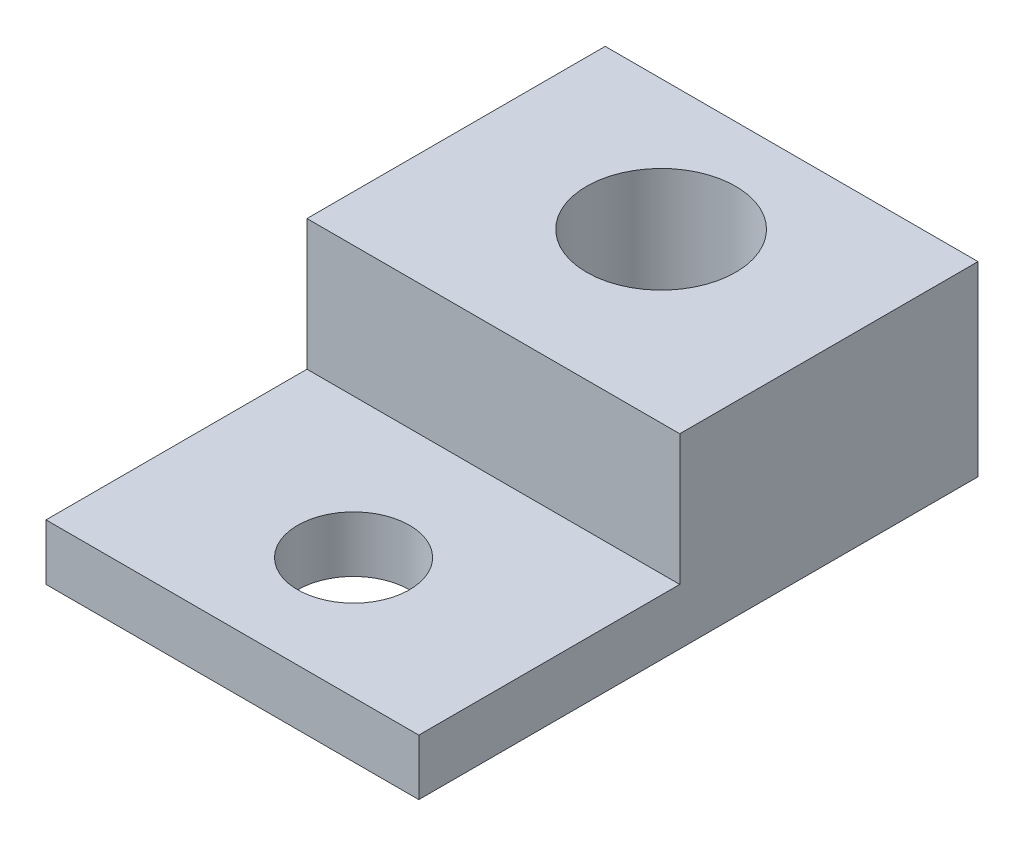
from build123d import *

# Parameters (mm, degrees)
SKETCH1_W               = 20
SKETCH1_H               = 30
BOSS_EXTRUDE1_DEPTH     = 3
SKETCH2_W               = 5
SKETCH2_H               = 12
BOSS_EXTRUDE2_DEPTH     = 3
SKETCH3_R               = 7
SKETCH3_R_2             = 4
BOSS_EXTRUDE3_DEPTH     = 7
SKETCH4_R               = 4
BOSS_EXTRUDE4_DEPTH     = 1
CUT_EXTRUDE1_DEPTH      = 20.339079606
CUT_EXTRUDE1_DEPTH_BACK = 20.339079606
SKETCH5_R               = 3
SKETCH6_R               = 7
SKETCH6_R_2             = 4
BOSS_EXTRUDE6_DEPTH     = 7


with BuildPart() as part:
    # Sketch1 → Boss-Extrude1 (new body)
    with BuildSketch(Plane(origin=(0, 0, 0), x_dir=(1, 0, 0), z_dir=(0, 1, 0))):
        Rectangle(SKETCH1_W, SKETCH1_H)
    extrude(amount=BOSS_EXTRUDE1_DEPTH)

    # Sketch2 → Boss-Extrude2 (add)
    with BuildSketch(Plane.XZ):
        with Locations((0, -9)):
            Rectangle(SKETCH2_W, SKETCH2_H)
    extrude(amount=BOSS_EXTRUDE2_DEPTH)

    # Sketch3 → Boss-Extrude3 (add)
    with BuildSketch(Plane(origin=(0, 3, 0), x_dir=(1, 0, 0), z_dir=(0, 1, 0))):
        with Locations(Location((0, 8, 0), (0, 0, 90))):
            Circle(SKETCH3_R)
        with Locations(Location((0, 8, 0), (0, 0, 270))):
            Circle(SKETCH3_R_2, mode=Mode.SUBTRACT)
    extrude(amount=BOSS_EXTRUDE3_DEPTH)

    # Sketch4 → Boss-Extrude4 (add)
    with BuildSketch(Plane(origin=(0, 3, 0), x_dir=(1, 0, 0), z_dir=(0, 1, 0))):
        with Locations(Location((0, 8, 0), (0, 0, 270))):
            Circle(SKETCH4_R)
    extrude(amount=BOSS_EXTRUDE4_DEPTH)

    # Sketch5 → Cut-Extrude1 (cut, two sides: drawn at the far end of the back side and taken through both)
    with BuildSketch(Plane(origin=(0, 3, 0), x_dir=(1, 0, 0), z_dir=(0, 1, 0)).offset(-CUT_EXTRUDE1_DEPTH_BACK)):
        with Locations(Location((0, -8.5, 0), (0, 0, 90))):
            Circle(SKETCH5_R)
    extrude(amount=CUT_EXTRUDE1_DEPTH + CUT_EXTRUDE1_DEPTH_BACK, mode=Mode.SUBTRACT)

    # Sketch6 → Boss-Extrude6 (add)
    # profile 1 of 2: a face of its own
    with BuildSketch(Plane(origin=(0, 3, 0), x_dir=(1, 0, 0), z_dir=(0, 1, 0))):
        Polygon((0, 15), (-10, 15), (-10, -1), (10, -1), (10, 15), align=None)
        with BuildLine():
            ThreePointArc((7, 8), (-4.949747468, 3.050252532), (0, 15))
            ThreePointArc((0, 15), (4.949747468, 12.949747468), (7, 8))
        make_face(mode=Mode.SUBTRACT)
    # profile 2 of 2: a face of its own
    with BuildSketch(Plane(origin=(0, 3, 0), x_dir=(1, 0, 0), z_dir=(0, 1, 0))):
        with Locations((0, 8)):
            Circle(SKETCH6_R)
        with Locations(Location((0, 8, 0), (0, 0, 270))):
            Circle(SKETCH6_R_2, mode=Mode.SUBTRACT)
    extrude(amount=BOSS_EXTRUDE6_DEPTH)


solid = part.part
